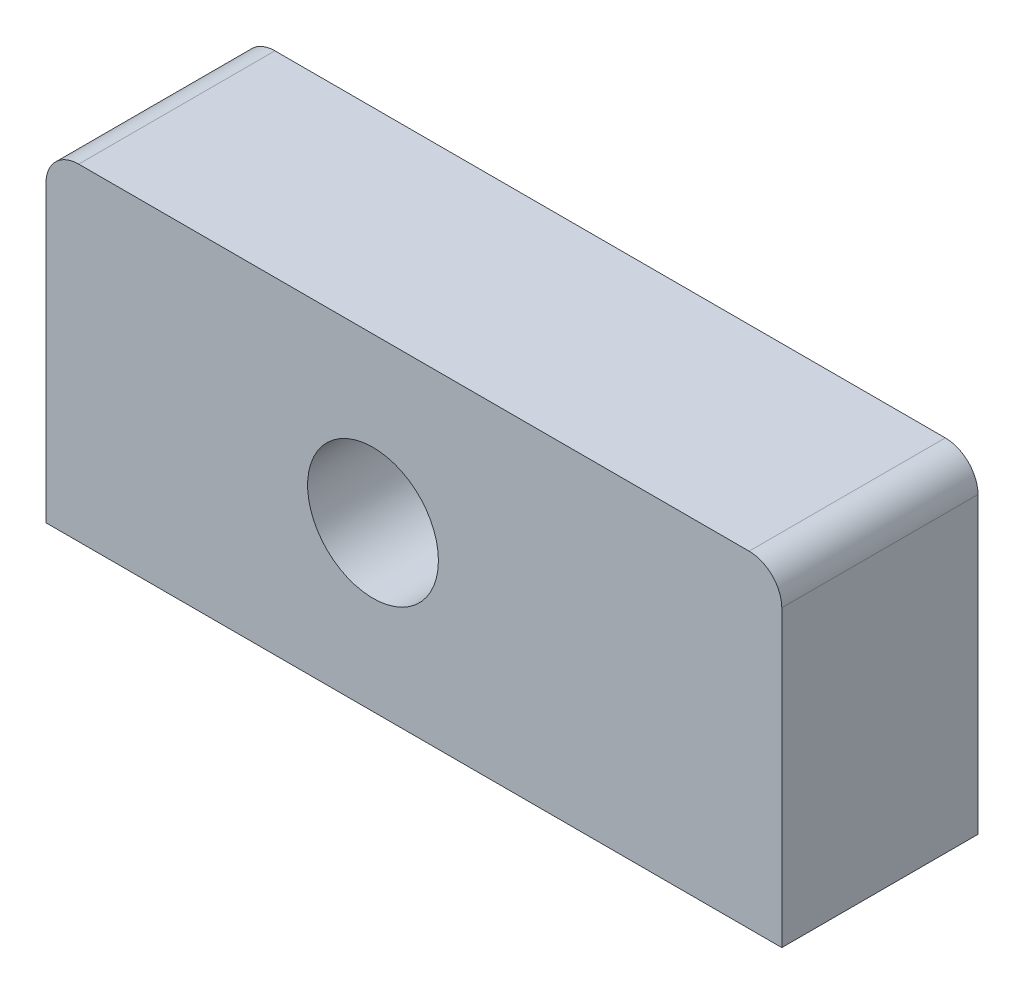
from build123d import *

# Parameters (mm, degrees)
SKETCH1_W           = 45
SKETCH1_H           = 20
SKETCH1_R           = 4
BOSS_EXTRUDE1_DEPTH = 12
FILLET1_R           = 2


with BuildPart() as part:
    # Sketch1 → Boss-Extrude1 (new body)
    with BuildSketch(Plane.XY):
        with Locations((22.5, 10)):
            Rectangle(SKETCH1_W, SKETCH1_H)
        with Locations((20, 10)):
            Circle(SKETCH1_R, mode=Mode.SUBTRACT)
    extrude(amount=BOSS_EXTRUDE1_DEPTH)

    # Fillet1
    fillet1_edges = [part.edges().sort_by_distance(p)[0] for p in [
        (0, 20, 6),
        (45, 20, 6),
    ]]
    fillet(fillet1_edges, radius=FILLET1_R)


solid = part.part
